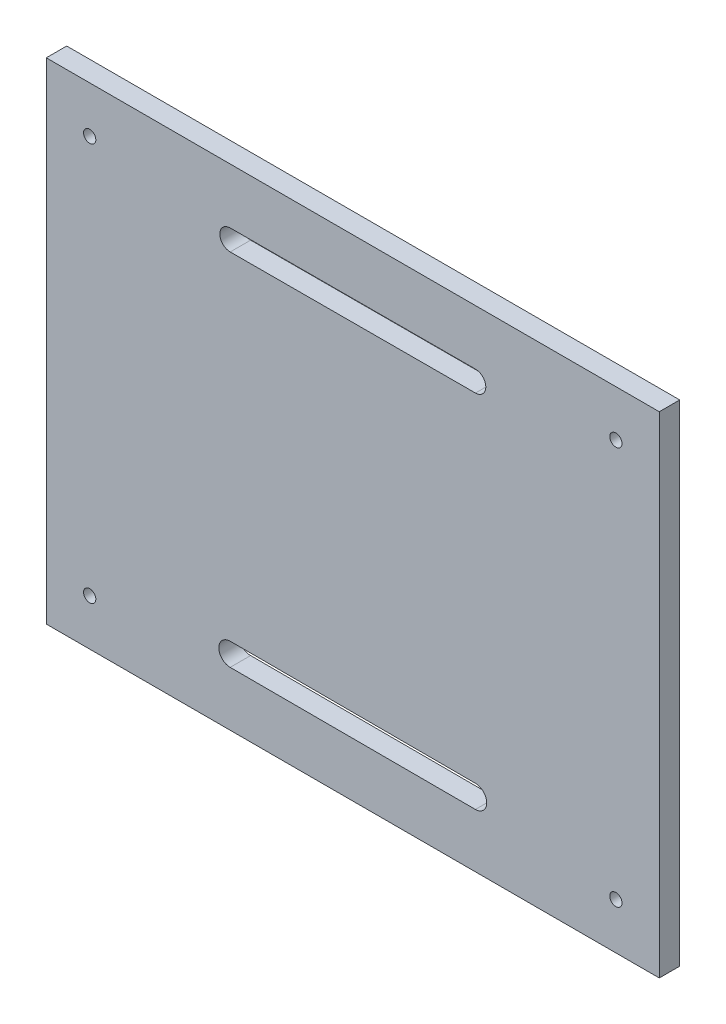
from build123d import *

# Parameters (mm, degrees)
MODEL_W             = 150
MODEL_H             = 120
MODEL_R             = 1.5
BOSS_EXTRUDE1_DEPTH = 5
CUT_EXTRUDE1_DEPTH  = 207.889226408


with BuildPart() as part:
    # Model → Boss-Extrude1 (new body)
    with BuildSketch(Plane.XY):
        with Locations((86.555612284, 69.143083993)):
            Rectangle(MODEL_W, MODEL_H)
        with Locations((22.178986017, 117.822854057)):
            Circle(MODEL_R, mode=Mode.SUBTRACT)
        with Locations((150.932238551, 117.822854057)):
            Circle(MODEL_R, mode=Mode.SUBTRACT)
        with Locations((22.178986017, 20.46331393)):
            Circle(MODEL_R, mode=Mode.SUBTRACT)
        with Locations((150.932238551, 20.46331393)):
            Circle(MODEL_R, mode=Mode.SUBTRACT)
    extrude(amount=BOSS_EXTRUDE1_DEPTH)

    # Sketch2 → Cut-Extrude1 (cut, through all)
    with BuildSketch(Plane.XY.offset(5)):
        with BuildLine():
            Line((56.551143806, 115.585597336), (116.559939574, 115.69114655))
            ThreePointArc((116.559939574, 115.69114655), (119.104909718, 113.155113361), (116.568876529, 110.610143217))
            Line((116.568876529, 110.610143217), (56.560080761, 110.504594003))
            ThreePointArc((56.560080761, 110.504594003), (54.015110617, 113.040627192), (56.551143806, 115.585597336))
        make_face()
        with BuildLine():
            Line((56.560484104, 28.010889901), (116.569279872, 27.905340687))
            ThreePointArc((116.569279872, 27.905340687), (119.334225635, 25.130651283), (116.559536231, 22.36570552))
            Line((116.559536231, 22.36570552), (56.550740464, 22.471254734))
            ThreePointArc((56.550740464, 22.471254734), (53.7857947, 25.245944138), (56.560484104, 28.010889901))
        make_face()
    extrude(amount=-CUT_EXTRUDE1_DEPTH, mode=Mode.SUBTRACT)


solid = part.part
